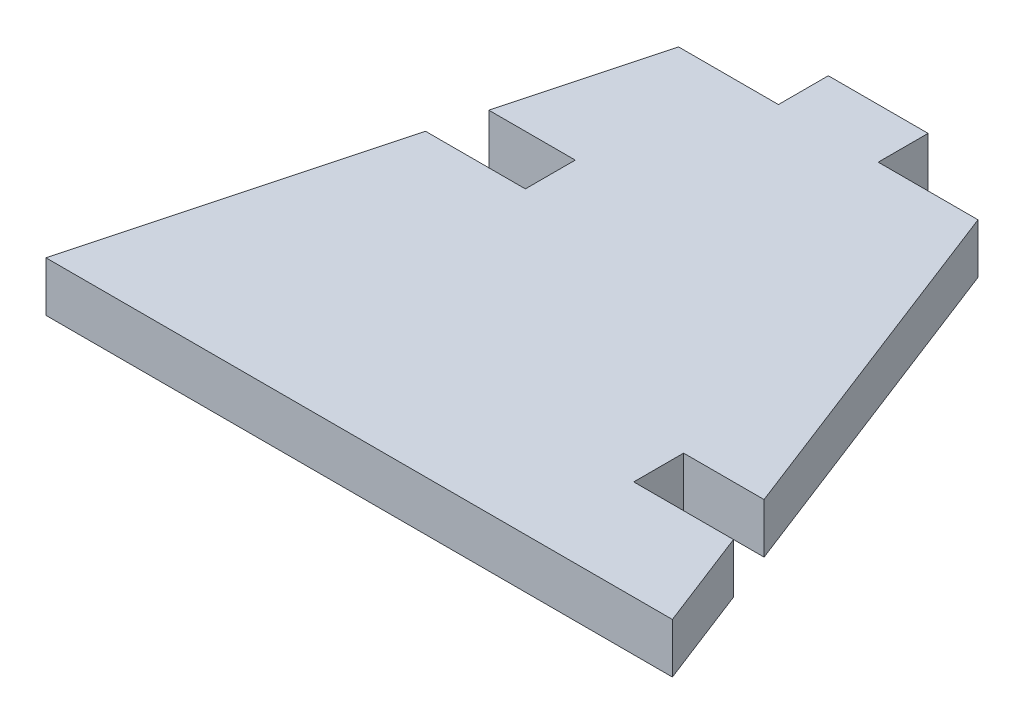
from build123d import *

# Parameters (mm, degrees)
BOSS_EXTRUDE1_DEPTH = 10


with BuildPart() as part:
    # Sketch1 → Boss-Extrude1 (new body)
    with BuildSketch(Plane(origin=(0, 0, 0), x_dir=(1, 0, 0), z_dir=(0, 1, 0))):
        Polygon((0, 0), (87.513060243, 0), (79.763338482, 20), (59.763338482, 20), (59.763338482, 30), (75.888477602, 30), (48.76445144, 100), (28.76445144, 100), (28.76445144, 110), (8.76445144, 110), (8.76445144, 100), (-11.23554856, 100), (-19.274024332, 70), (-1.953516257, 70), (-1.953516257, 60), (-21.953516257, 60), (-38.030467803, 0), align=None)
    extrude(amount=BOSS_EXTRUDE1_DEPTH)


solid = part.part
